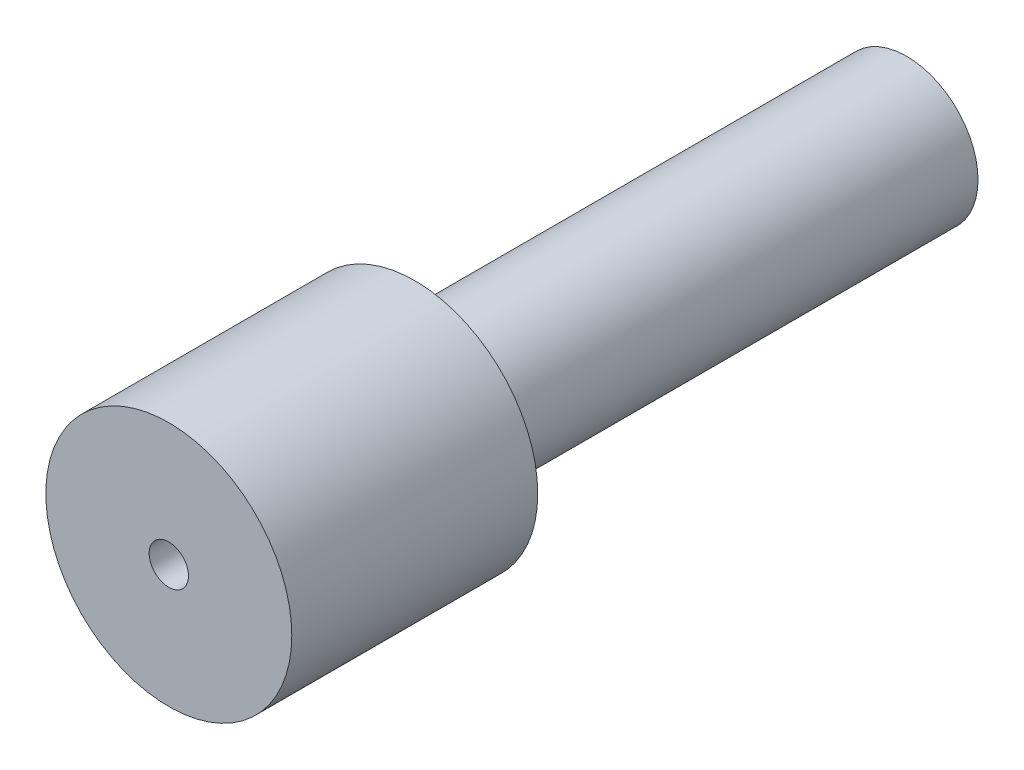
from build123d import *


with BuildPart() as part:
    # Sketch2 → Revolve1 (revolve)
    with BuildSketch(Plane(origin=(0, 0, 0), x_dir=(1, 0, 0), z_dir=(0, 1, 0)), mode=Mode.PRIVATE) as revolve1_sk:
        Polygon((-1.016, 0), (-6.35, 0), (-6.35, 12.7), (-4.953, 12.7), (-3.683, 13.97), (-3.683, 38.1), (-2.0955, 38.1), (-2.0955, 10.16), (-1.016, 10.16), align=None)
    revolve(revolve1_sk.sketch.rotate(Axis((0, 0, 0), (0, 0, -1)), 180), axis=Axis((0, 0, 0), (0, 0, -1)))


solid = part.part
